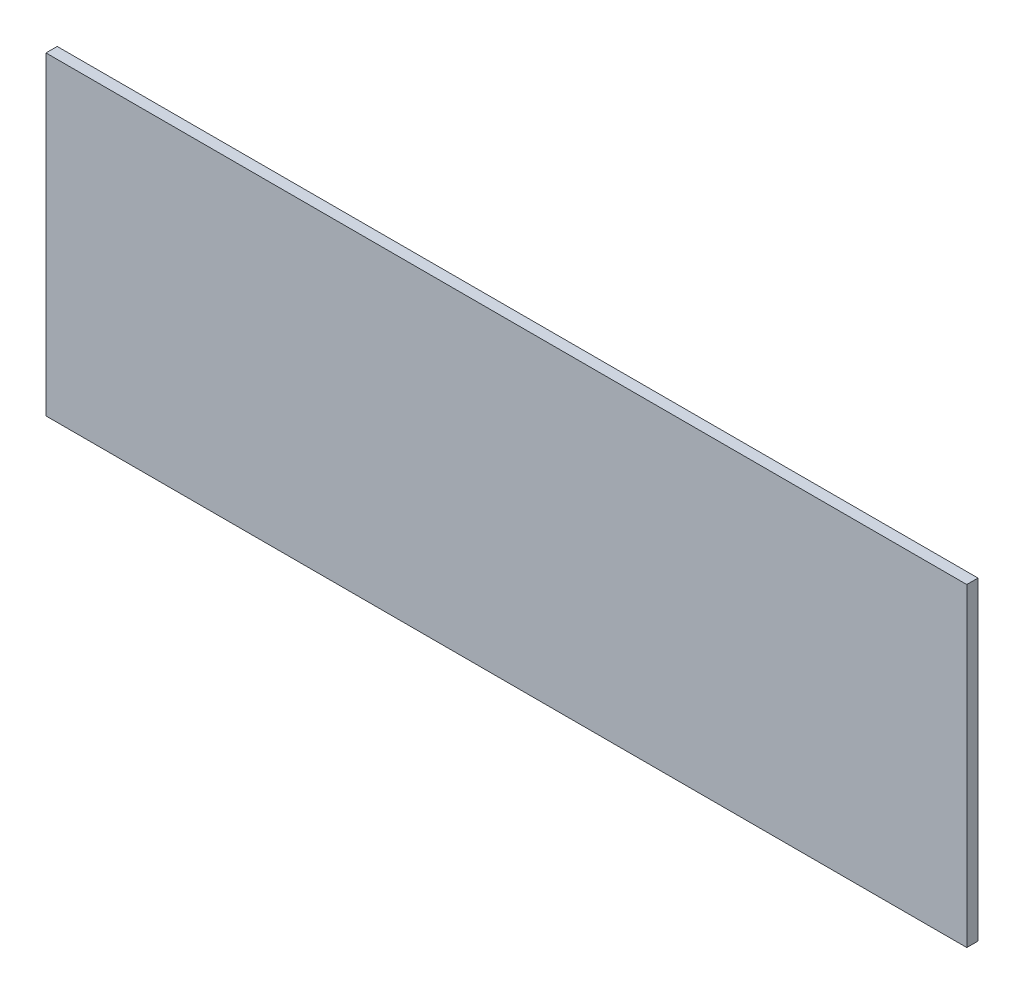
from build123d import *

# Parameters (mm, degrees)
SKETCH_1_W      = 410
SKETCH_1_H      = 140
EXTRUDE_1_DEPTH = 5


with BuildPart() as part:
    # ｽｹｯﾁ1 → ﾎﾞｽ - 押し出し1 (new body)
    with BuildSketch(Plane.XY):
        with Locations((135.719868277, 91.507142857)):
            Rectangle(SKETCH_1_W, SKETCH_1_H)
    extrude(amount=EXTRUDE_1_DEPTH)


solid = part.part
